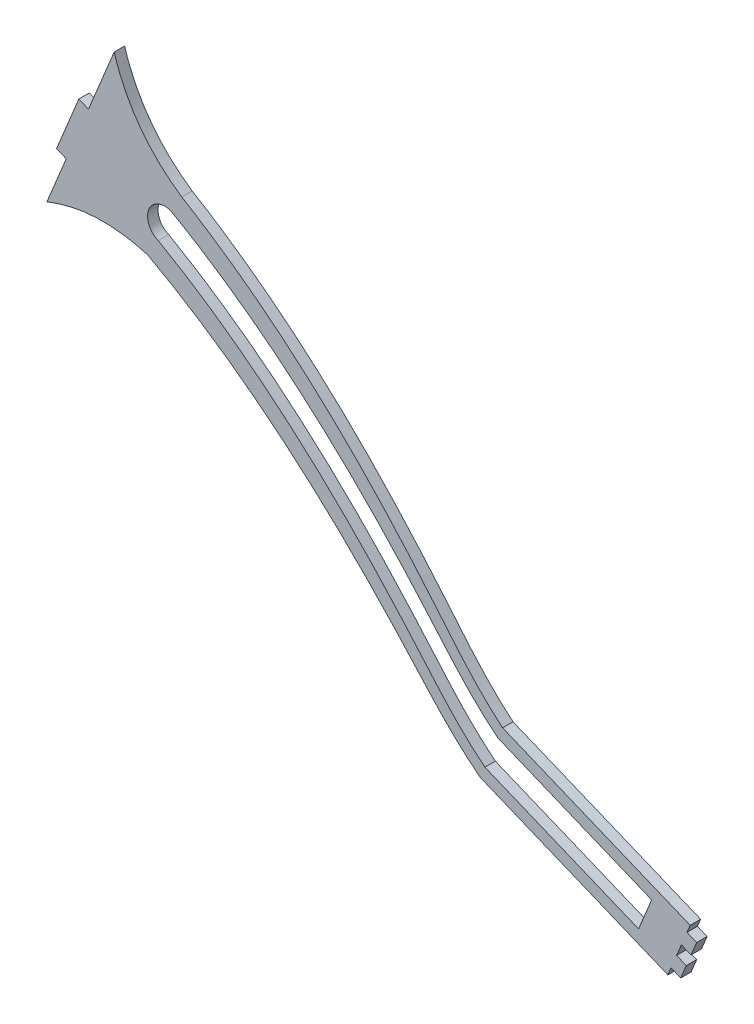
from build123d import *

# Parameters (mm, degrees)
BOSS_EXTRUDE1_DEPTH = 5


with BuildPart() as part:
    # Sketch2 → Boss-Extrude1 (new body)
    with BuildSketch(Plane.XY.offset(324.609115736)):
        with BuildLine():
            Line((-16.90012844, -8.183190187), (72.816503584, -45.112441184))
            Line((72.816503584, -45.112441184), (74.339048342, -41.413541691))
            Line((74.339048342, -41.413541691), (78.962672709, -43.316722639))
            Line((78.962672709, -43.316722639), (81.627126035, -36.843648526))
            Line((81.627126035, -36.843648526), (77.003501669, -34.940467578))
            Line((77.003501669, -34.940467578), (79.287318806, -29.392118339))
            Line((79.287318806, -29.392118339), (83.910943172, -31.295299286))
            Line((83.910943172, -31.295299286), (86.575396499, -24.822225173))
            Line((86.575396499, -24.822225173), (81.951772132, -22.919044226))
            Line((81.951772132, -22.919044226), (83.47431689, -19.220144733))
            Line((83.47431689, -19.220144733), (-6.242315134, 17.709106264))
            add(Edge.make_bspline(
                [(-6.242315134, 17.709106264), (-19.147085678, 28.427579084), (-62.609683594, 83.624540664), (-113.341454038, 133.123455083), (-159.667254415, 160.823469136)],
                knots=[0, 0, 0, 0, 0.237148473, 1, 1, 1, 1], degree=3))
            add(Edge.make_bspline(
                [(-192.022205471, 204.724702407), (-183.525718419, 177.076811357), (-159.667254415, 160.823469136)],
                knots=[0, 0, 0, 1, 1, 1], degree=2))
            Line((-192.022205471, 204.724702407), (-204.287606756, 174.926900827))
            Line((-204.287606756, 174.926900827), (-208.911231122, 176.830081774))
            Line((-208.911231122, 176.830081774), (-219.569044429, 150.937785322))
            Line((-219.569044429, 150.937785322), (-214.945420062, 149.034604375))
            Line((-214.945420062, 149.034604375), (-224.18290752, 126.592874832))
            add(Edge.make_bspline(
                [(-175.911850273, 128.697068335), (-200.797987469, 136.066038881), (-224.18290752, 126.592874832)],
                knots=[0, 0, 0, 1, 1, 1], degree=2))
            add(Edge.make_bspline(
                [(-16.90012844, -8.183190187), (-30.222192507, 2.01197393), (-75.852029724, 55.431258283), (-128.517955825, 102.867060046), (-175.911850273, 128.697068335)],
                knots=[0, 0, 0, 0, 0.237148473, 1, 1, 1, 1], degree=3))
        make_face()
        with BuildLine():
            Line((65.049758472, -17.908345143), (-8.450005033, 12.345702))
            add(Edge.make_bspline(
                [(-8.450005033, 12.345702), (-21.566591824, 22.803900379), (-66.124581019, 77.120450197), (-117.836312175, 125.594689972), (-164.70691842, 152.362521961)],
                knots=[0, 0, 0, 0, 0.237148473, 1, 1, 1, 1], degree=3))
            ThreePointArc((-164.70691842, 152.362521961), (-175.410879134, 147.900994755), (-170.949351927, 137.19703404))
            add(Edge.make_bspline(
                [(-14.692438541, -2.819785922), (-27.809025332, 7.638412457), (-72.367014526, 61.954962275), (-124.078745683, 110.429202051), (-170.949351927, 137.19703404)],
                knots=[0, 0, 0, 0, 0.237148473, 1, 1, 1, 1], degree=3))
            Line((-14.692438541, -2.819785922), (58.807324964, -33.073833065))
            Line((58.807324964, -33.073833065), (65.049758472, -17.908345143))
        make_face(mode=Mode.SUBTRACT)
    extrude(amount=-BOSS_EXTRUDE1_DEPTH)


solid = part.part
